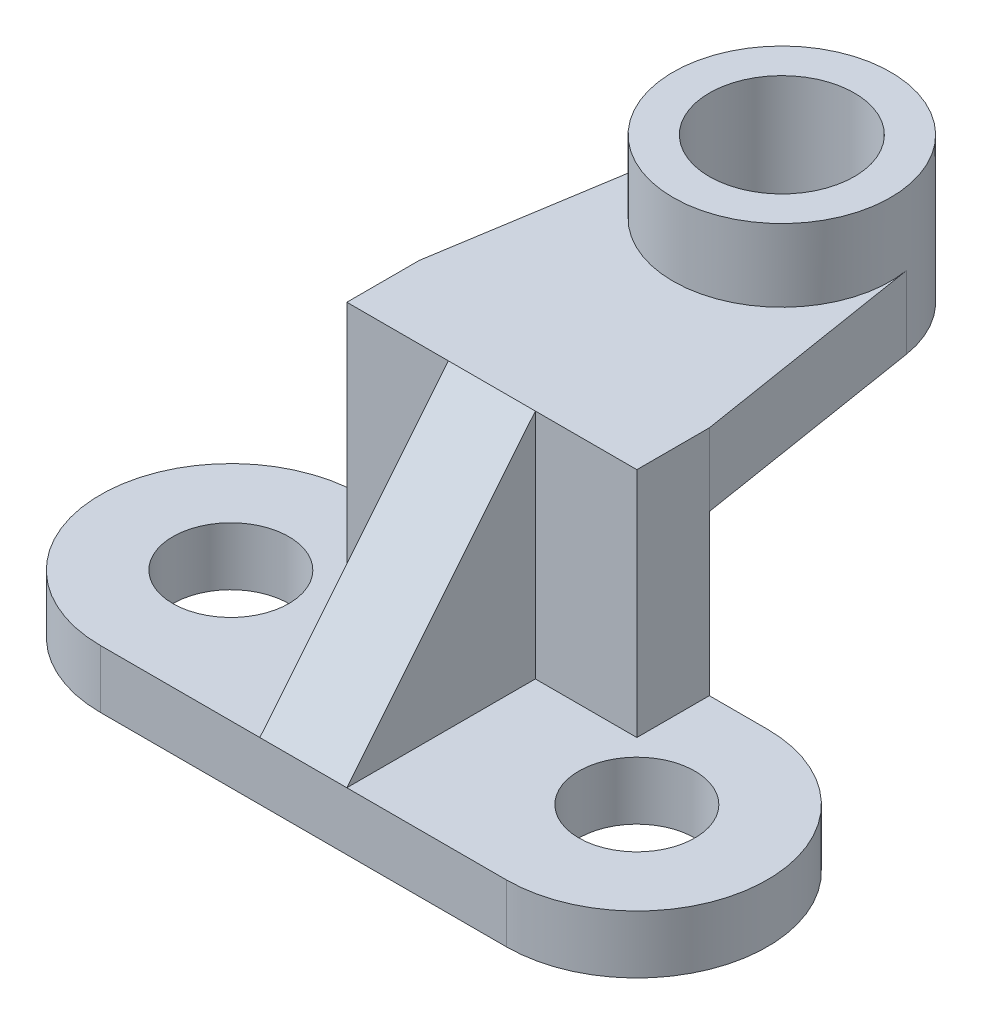
from build123d import *

# Parameters (mm, degrees)
SKETCH2_R                = 8
BOSS_EXTRUDE1_DEPTH      = 8
SKETCH4_W                = 40
SKETCH4_H                = 10
BOSS_EXTRUDE2_DEPTH      = 32
BOSS_EXTRUDE3_DEPTH      = 6
BOSS_EXTRUDE3_DEPTH_BACK = 6
SKETCH7_R                = 10
BOSS_EXTRUDE4_DEPTH      = 10
BOSS_EXTRUDE5_START      = 10
SKETCH8_R                = 15
SKETCH8_R_2              = 10
BOSS_EXTRUDE5_DEPTH      = 10


with BuildPart() as part:
    # Sketch2 → Boss-Extrude1 (new body)
    with BuildSketch(Plane(origin=(0, 0, 0), x_dir=(1, 0, 0), z_dir=(0, 1, 0))):
        with BuildLine():
            Line((-28, 18), (28, 18))
            ThreePointArc((28, 18), (46, 0), (28, -18))
            Line((28, -18), (-28, -18))
            ThreePointArc((-28, -18), (-46, 0), (-28, 18))
        make_face()
        with Locations(Location((-28, 0, 0), (0, 0, 270))):
            Circle(SKETCH2_R, mode=Mode.SUBTRACT)
        with Locations(Location((28, 0, 0), (0, 0, 270))):
            Circle(SKETCH2_R, mode=Mode.SUBTRACT)
    extrude(amount=BOSS_EXTRUDE1_DEPTH)

    # Sketch4 → Boss-Extrude2 (add)
    with BuildSketch(Plane(origin=(0, 8, 0), x_dir=(1, 0, 0), z_dir=(0, 1, 0))):
        with Locations((0, 13)):
            Rectangle(SKETCH4_W, SKETCH4_H)
    extrude(amount=BOSS_EXTRUDE2_DEPTH)

    # Sketch5 → Boss-Extrude3 (add, two sides: drawn at the far end of the back side and taken through both)
    with BuildSketch(Plane(origin=(0, 0, 0), x_dir=(0, 0, -1), z_dir=(1, 0, 0)).offset(-BOSS_EXTRUDE3_DEPTH_BACK)):
        Polygon((8, 40), (8, 8), (-18, 8), align=None)
    extrude(amount=BOSS_EXTRUDE3_DEPTH + BOSS_EXTRUDE3_DEPTH_BACK)

    # Sketch7 → Boss-Extrude4 (add)
    with BuildSketch(Plane(origin=(0, 40, 0), x_dir=(1, 0, 0), z_dir=(0, 1, 0))):
        with BuildLine():
            Line((20, 18), (14.810951292, 50.373967528))
            ThreePointArc((14.810951292, 50.373967528), (0, 63), (-14.810951292, 50.373967528))
            Line((-14.810951292, 50.373967528), (-20, 18))
            Line((-20, 18), (20, 18))
        make_face()
        with Locations(Location((0, 48, 0), (0, 0, 270))):
            Circle(SKETCH7_R, mode=Mode.SUBTRACT)
    extrude(amount=-BOSS_EXTRUDE4_DEPTH)

    # Sketch8 → Boss-Extrude5 (add)
    with BuildSketch(Plane(origin=(0, 40, 0), x_dir=(1, 0, 0), z_dir=(0, 1, 0)).offset(BOSS_EXTRUDE5_START)):
        with Locations(Location((0, 48, 0), (0, 0, 270))):
            Circle(SKETCH8_R)
        with Locations(Location((0, 48, 0), (0, 0, 270))):
            Circle(SKETCH8_R_2, mode=Mode.SUBTRACT)
    extrude(amount=-BOSS_EXTRUDE5_DEPTH)


solid = part.part
